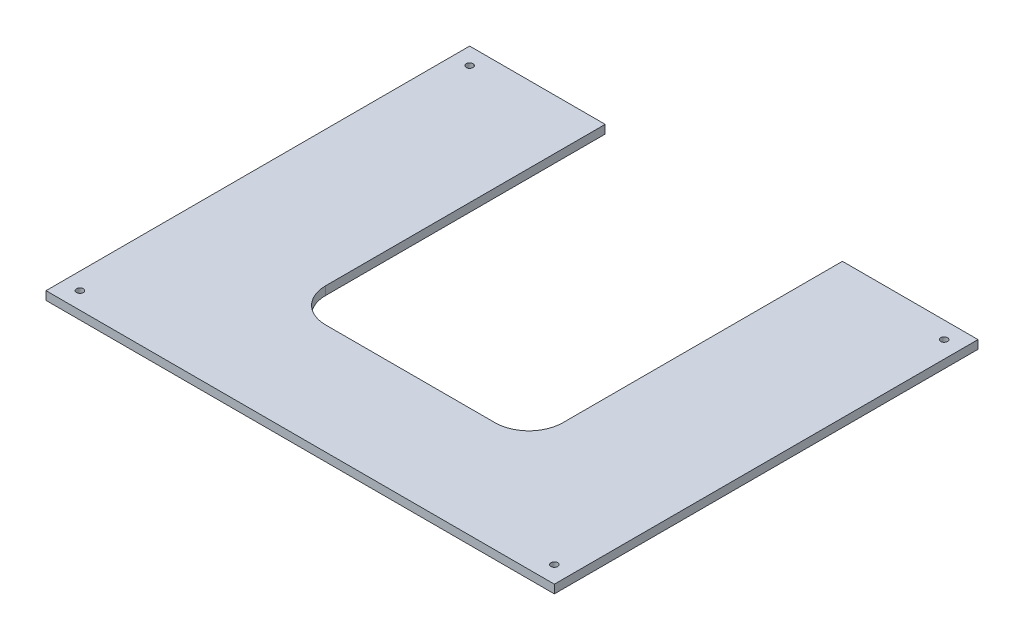
from build123d import *

# Parameters (mm, degrees)
SKETCH1_W           = 300
SKETCH1_H           = 250
SKETCH1_R           = 2
BOSS_EXTRUDE1_DEPTH = 5
SKETCH2_W           = 140
SKETCH2_H           = 185
CUT_EXTRUDE1_DEPTH  = 196.320249846
FILLET1_R           = 20


with BuildPart() as part:
    # Sketch1 → Boss-Extrude1 (new body)
    with BuildSketch(Plane(origin=(0, 0, 0), x_dir=(1, 0, 0), z_dir=(0, 1, 0))):
        Rectangle(SKETCH1_W, SKETCH1_H)
        with Locations(Location((-140, -115, 0), (0, 0, 270))):
            Circle(SKETCH1_R, mode=Mode.SUBTRACT)
        with Locations(Location((-140, 115, 0), (0, 0, 90))):
            Circle(SKETCH1_R, mode=Mode.SUBTRACT)
        with Locations(Location((140, -115, 0), (0, 0, 90))):
            Circle(SKETCH1_R, mode=Mode.SUBTRACT)
        with Locations(Location((140, 115, 0), (0, 0, 270))):
            Circle(SKETCH1_R, mode=Mode.SUBTRACT)
    extrude(amount=BOSS_EXTRUDE1_DEPTH)

    # Sketch2 → Cut-Extrude1 (cut, through all)
    with BuildSketch(Plane(origin=(0, 5, 0), x_dir=(1, 0, 0), z_dir=(0, 1, 0))):
        with Locations((0, 32.5)):
            Rectangle(SKETCH2_W, SKETCH2_H)
    extrude(amount=-CUT_EXTRUDE1_DEPTH, mode=Mode.SUBTRACT)

    # Fillet1
    fillet1_edges = [part.edges().sort_by_distance(p)[0] for p in [
        (-70, 2.5, 60),
        (70, 2.5, 60),
    ]]
    fillet(fillet1_edges, radius=FILLET1_R)


solid = part.part
